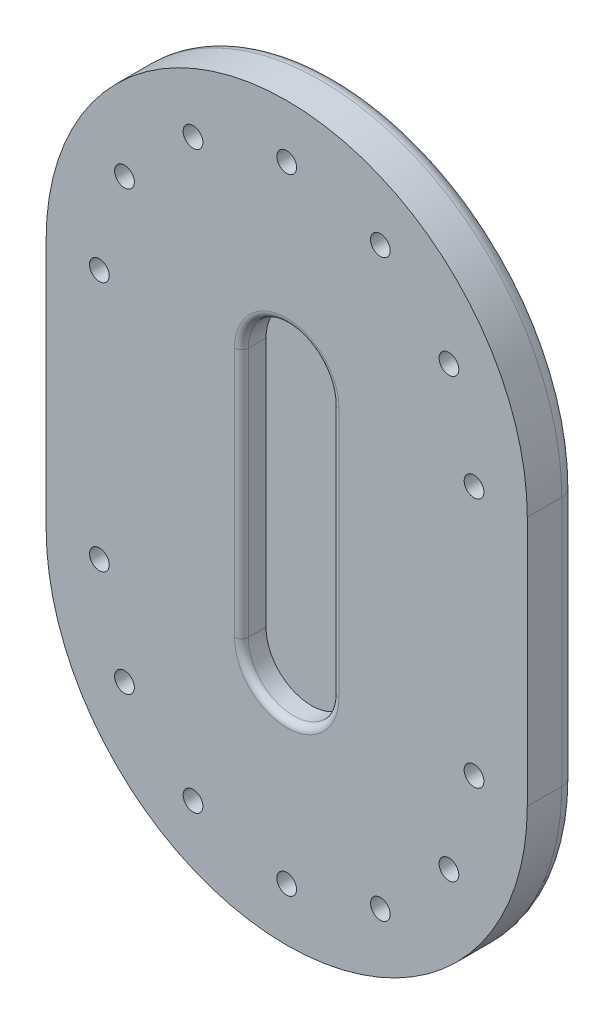
from build123d import *

# Parameters (mm, degrees)
BOSS_EXTRUDE1_DEPTH        = 12.5
CUT_EXTRUDE1_DEPTH         = 6.25
HOLE2_D                    = 5
HOLE2_DEPTH                = 100
HOLE2_CBORE_D              = 9
HOLE2_CBORE_DEPTH          = 5
CIRPATTERN1_COUNT          = 7
CIRPATTERN1_ANGLE          = 180
MIRROR1_COPY_1_D           = 5
MIRROR1_COPY_1_DEPTH       = 100
MIRROR1_COPY_1_CBORE_D     = 9
MIRROR1_COPY_1_CBORE_DEPTH = 5
MIRROR1_COPY_2_D           = 5
MIRROR1_COPY_2_DEPTH       = 100
MIRROR1_COPY_2_CBORE_D     = 9
MIRROR1_COPY_2_CBORE_DEPTH = 5
MIRROR1_COPY_3_D           = 5
MIRROR1_COPY_3_DEPTH       = 100
MIRROR1_COPY_3_CBORE_D     = 9
MIRROR1_COPY_3_CBORE_DEPTH = 5
MIRROR1_COPY_4_D           = 5
MIRROR1_COPY_4_DEPTH       = 100
MIRROR1_COPY_4_CBORE_D     = 9
MIRROR1_COPY_4_CBORE_DEPTH = 5
MIRROR1_COPY_5_D           = 5
MIRROR1_COPY_5_DEPTH       = 100
MIRROR1_COPY_5_CBORE_D     = 9
MIRROR1_COPY_5_CBORE_DEPTH = 5
MIRROR1_COPY_6_D           = 5
MIRROR1_COPY_6_DEPTH       = 100
MIRROR1_COPY_6_CBORE_D     = 9
MIRROR1_COPY_6_CBORE_DEPTH = 5
MIRROR1_COPY_7_D           = 5
MIRROR1_COPY_7_DEPTH       = 100
MIRROR1_COPY_7_CBORE_D     = 9
MIRROR1_COPY_7_CBORE_DEPTH = 5
FILLET1_R                  = 3.75
FILLET2_R                  = 1.75


with BuildPart() as part:
    # Sketch1 → Boss-Extrude1 (new body)
    with BuildSketch(Plane.XY):
        with BuildLine():
            Line((-61, -31.75), (-61, 31.75))
            ThreePointArc((-61, 31.75), (0, 92.75), (61, 31.75))
            Line((61, 31.75), (61, -31.75))
            ThreePointArc((61, -31.75), (0, -92.75), (-61, -31.75))
        make_face()
    extrude(amount=-BOSS_EXTRUDE1_DEPTH)

    # Sketch1<3> → Cut-Extrude1 (cut)
    with BuildSketch(Plane.XY):
        with BuildLine():
            Line((-11.5, -31.75), (-11.5, 31.75))
            ThreePointArc((-11.5, 31.75), (0, 43.25), (11.5, 31.75))
            Line((11.5, 31.75), (11.5, -31.75))
            ThreePointArc((11.5, -31.75), (0, -43.25), (-11.5, -31.75))
        make_face()
    extrude(amount=-CUT_EXTRUDE1_DEPTH, mode=Mode.SUBTRACT)

    # Hole2
    with Locations(Plane(origin=(0, 0, -12.5), x_dir=(-1, 0, 0), z_dir=(0, 0, -1))):
        with Locations((47.5, 31.75)):
            hole2 = CounterBoreHole(HOLE2_D / 2, HOLE2_CBORE_D / 2, HOLE2_CBORE_DEPTH, depth=HOLE2_DEPTH)

    # CirPattern1: Hole2 ×7 about axis
    cirpattern1_axis = Axis((0, 31.75, -12.5), (0, 0, -1))
    for i in range(1, CIRPATTERN1_COUNT):
        add(hole2.rotate(cirpattern1_axis, i * CIRPATTERN1_ANGLE / (CIRPATTERN1_COUNT - 1)), mode=Mode.SUBTRACT)

    # Mirror1 copy 1
    with Locations(Plane(origin=(-15.875, -4.25369343, -12.5), x_dir=(-0.866025403784438, -0.500000000000001, 0), z_dir=(0, 0, -1))):
        with Locations((47.5, -31.75)):
            CounterBoreHole(MIRROR1_COPY_1_D / 2, MIRROR1_COPY_1_CBORE_D / 2, MIRROR1_COPY_1_CBORE_DEPTH, depth=MIRROR1_COPY_1_DEPTH)

    # Mirror1 copy 2
    with Locations(Plane(origin=(-27.49630657, -15.875, -12.5), x_dir=(-0.499999999999998, -0.8660254037844398, 0), z_dir=(0, 0, -1))):
        with Locations((47.5, -31.75)):
            CounterBoreHole(MIRROR1_COPY_2_D / 2, MIRROR1_COPY_2_CBORE_D / 2, MIRROR1_COPY_2_CBORE_DEPTH, depth=MIRROR1_COPY_2_DEPTH)

    # Mirror1 copy 3
    with Locations(Plane(origin=(-31.75, -31.75, -12.5), x_dir=(0, -1, 0), z_dir=(0, 0, -1))):
        with Locations((47.5, -31.75)):
            CounterBoreHole(MIRROR1_COPY_3_D / 2, MIRROR1_COPY_3_CBORE_D / 2, MIRROR1_COPY_3_CBORE_DEPTH, depth=MIRROR1_COPY_3_DEPTH)

    # Mirror1 copy 4
    with Locations(Plane(origin=(-27.49630657, -47.625, -12.5), x_dir=(0.500000000000004, -0.8660254037844363, 0), z_dir=(0, 0, -1))):
        with Locations((47.5, -31.75)):
            CounterBoreHole(MIRROR1_COPY_4_D / 2, MIRROR1_COPY_4_CBORE_D / 2, MIRROR1_COPY_4_CBORE_DEPTH, depth=MIRROR1_COPY_4_DEPTH)

    # Mirror1 copy 5
    with Locations(Plane(origin=(-15.875, -59.24630657, -12.5), x_dir=(0.8660254037844416, -0.49999999999999495, 0), z_dir=(0, 0, -1))):
        with Locations((47.5, -31.75)):
            CounterBoreHole(MIRROR1_COPY_5_D / 2, MIRROR1_COPY_5_CBORE_D / 2, MIRROR1_COPY_5_CBORE_DEPTH, depth=MIRROR1_COPY_5_DEPTH)

    # Mirror1 copy 6
    with Locations(Plane(origin=(0, -63.5, -12.5), x_dir=(1, 0, 0), z_dir=(0, 0, -1))):
        with Locations((47.5, -31.75)):
            CounterBoreHole(MIRROR1_COPY_6_D / 2, MIRROR1_COPY_6_CBORE_D / 2, MIRROR1_COPY_6_CBORE_DEPTH, depth=MIRROR1_COPY_6_DEPTH)

    # Mirror1 copy 7
    with Locations(Plane(origin=(0, 0, -12.5), x_dir=(-1, 0, 0), z_dir=(0, 0, -1))):
        with Locations((47.5, -31.75)):
            CounterBoreHole(MIRROR1_COPY_7_D / 2, MIRROR1_COPY_7_CBORE_D / 2, MIRROR1_COPY_7_CBORE_DEPTH, depth=MIRROR1_COPY_7_DEPTH)

    # Fillet1
    fillet1_edges = [part.edges().sort_by_distance(p)[0] for p in [
        (61, 0, -12.5),
        (0, -92.75, -12.5),
        (-61, 0, -12.5),
        (0, 92.75, -12.5),
    ]]
    fillet(fillet1_edges, radius=FILLET1_R)

    # Fillet2
    fillet2_edges = [part.edges().sort_by_distance(p)[0] for p in [
        (0, -43.25, 0),
        (11.5, 0, 0),
        (0, 43.25, 0),
        (-11.5, 0, 0),
    ]]
    fillet(fillet2_edges, radius=FILLET2_R)


solid = part.part
